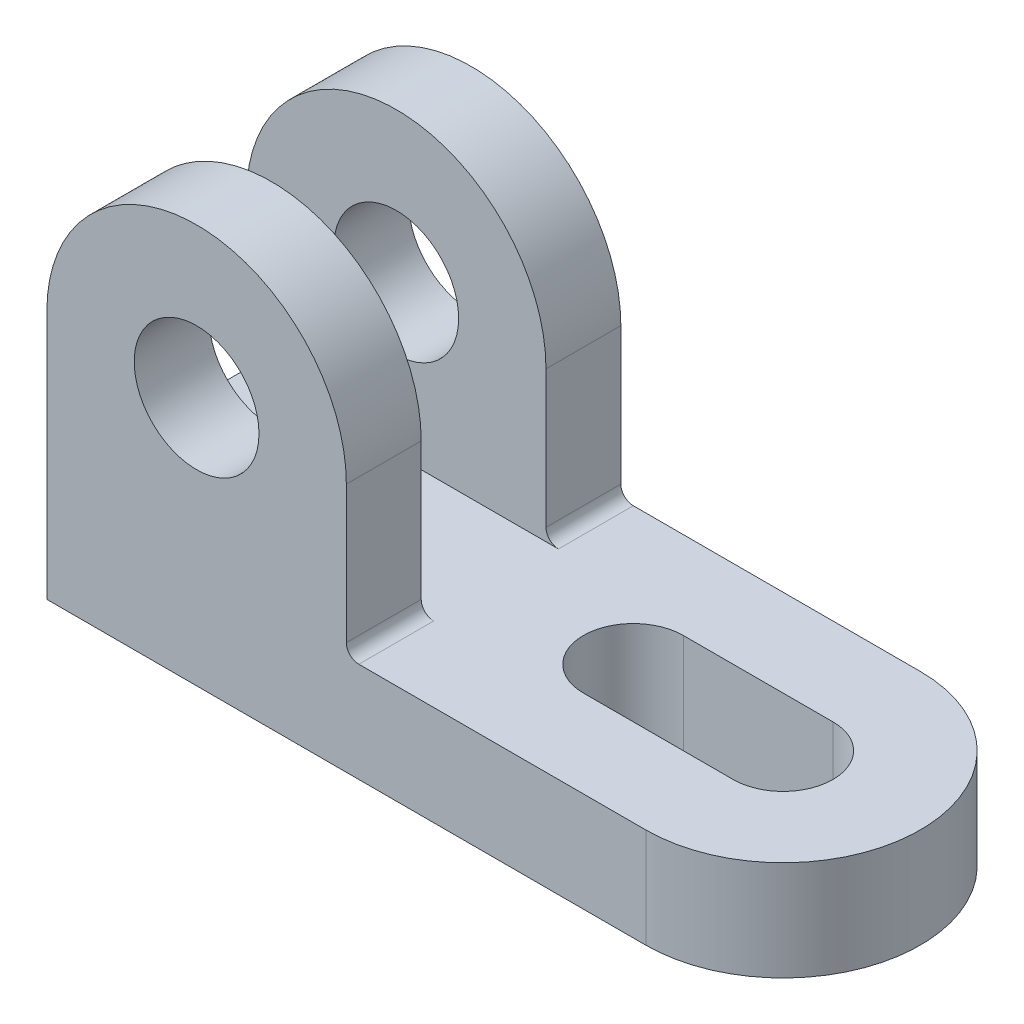
from build123d import *

# Parameters (mm, degrees)
BOSS_EXTRUDE1_DEPTH = 16
BOSS_EXTRUDE2_START = 10
SKETCH3_R           = 10
BOSS_EXTRUDE2_DEPTH = 12
BOSS_EXTRUDE3_START = -22
SKETCH3_3_R         = 10
BOSS_EXTRUDE3_DEPTH = 12
FILLET1_R           = 2


with BuildPart() as part:
    # Sketch2 → Boss-Extrude1 (new body)
    with BuildSketch(Plane(origin=(0, 0, 0), x_dir=(1, 0, 0), z_dir=(0, 1, 0))):
        with BuildLine():
            Line((0, 22), (0, -22))
            Line((0, -22), (96, -22))
            ThreePointArc((96, -22), (118, 0), (96, 22))
            Line((96, 22), (0, 22))
        make_face()
        with BuildLine():
            Line((72, 8), (96, 8))
            ThreePointArc((96, 8), (104, 0), (96, -8))
            Line((96, -8), (72, -8))
            ThreePointArc((72, -8), (64, 0), (72, 8))
        make_face(mode=Mode.SUBTRACT)
    extrude(amount=BOSS_EXTRUDE1_DEPTH)

    # Sketch3 → Boss-Extrude2 (add)
    with BuildSketch(Plane.XY.offset(BOSS_EXTRUDE2_START)):
        with BuildLine():
            Line((0, 40), (0, 0))
            Line((0, 0), (48, 0))
            Line((48, 0), (48, 40))
            ThreePointArc((48, 40), (24, 64), (0, 40))
        make_face()
        with Locations((24, 40)):
            Circle(SKETCH3_R, mode=Mode.SUBTRACT)
    extrude(amount=BOSS_EXTRUDE2_DEPTH)

    # Sketch3<3> → Boss-Extrude3 (add)
    with BuildSketch(Plane.XY.offset(BOSS_EXTRUDE3_START)):
        with BuildLine():
            Line((0, 40), (0, 0))
            Line((0, 0), (48, 0))
            Line((48, 0), (48, 40))
            ThreePointArc((48, 40), (24, 64), (0, 40))
        make_face()
        with Locations((24, 40)):
            Circle(SKETCH3_3_R, mode=Mode.SUBTRACT)
    extrude(amount=BOSS_EXTRUDE3_DEPTH)

    # Fillet1
    fillet1_edges = [part.edges().sort_by_distance(p)[0] for p in [
        (48, 16, -16),
        (48, 16, 16),
    ]]
    fillet(fillet1_edges, radius=FILLET1_R)


solid = part.part
